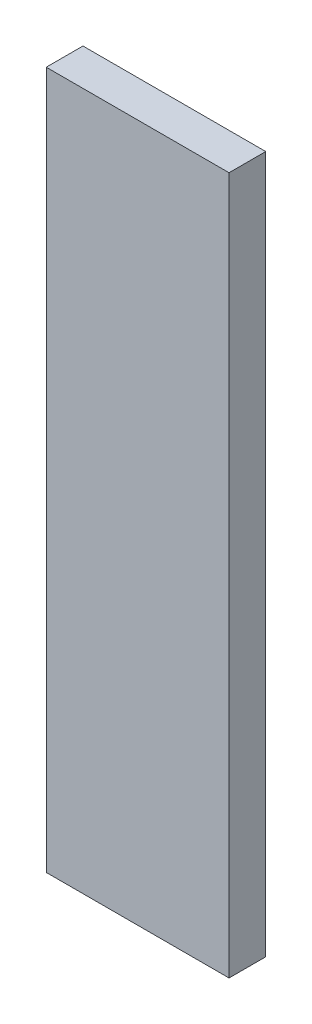
from build123d import *

# Parameters (mm, degrees)
SKETCH_1_W          = 49.8
SKETCH_1_H          = 190
EXTRUDE_1_DEPTH     = 5
SKETCH_3_W          = 30.4
SKETCH_3_H          = 6.3
CUT_EXTRUDE_1_DEPTH = 50


with BuildPart() as part:
    # 草图1 → 凸台-拉伸1 (new, symmetric)
    with BuildSketch(Plane.XY):
        Rectangle(SKETCH_1_W, SKETCH_1_H)
    extrude(amount=EXTRUDE_1_DEPTH, both=True)

    # 草图3 → 切除-拉伸1 (cut)
    with BuildSketch(Plane.XZ.offset(95)):
        Rectangle(SKETCH_3_W, SKETCH_3_H)
    extrude(amount=-CUT_EXTRUDE_1_DEPTH, mode=Mode.SUBTRACT)


solid = part.part
